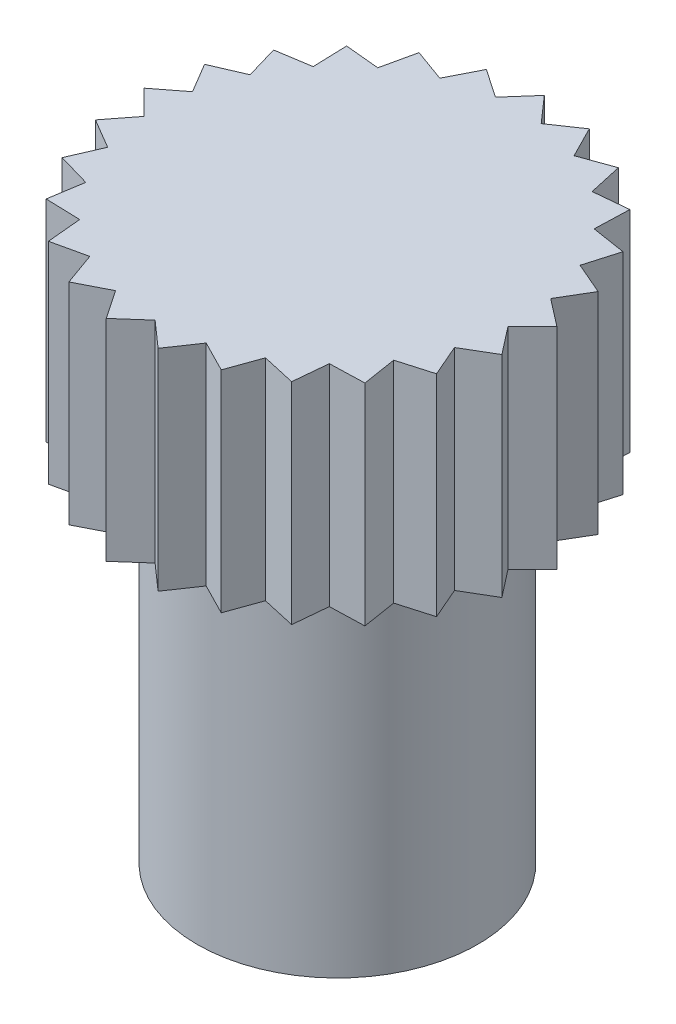
from build123d import *

# Parameters (mm, degrees)
SKETCH1_R           = 2
BOSS_EXTRUDE1_DEPTH = 5.01
BOSS_EXTRUDE2_DEPTH = 3


with BuildPart() as part:
    # Sketch1 → Boss-Extrude1 (new body)
    with BuildSketch(Plane(origin=(0, 0, 0), x_dir=(1, 0, 0), z_dir=(0, 1, 0))):
        with Locations(Location((0, 0, 0), (0, 0, 270))):
            Circle(SKETCH1_R)
    extrude(amount=BOSS_EXTRUDE1_DEPTH)

    # Sketch4 → Boss-Extrude2 (add)
    with BuildSketch(Plane(origin=(0, 5.01, 0), x_dir=(1, 0, 0), z_dir=(0, 1, 0))):
        Polygon((-0.325866407, 2.579498223), (0, 2.95), (0.325866407, 2.579498223), (0.733635167, 2.857320325), (0.957123837, 2.417418863), (1.421173339, 2.585104706), (1.528241656, 2.103444185), (2.019413962, 2.150457451), (2.003334431, 1.657302373), (2.49076738, 1.580689045), (2.352550336, 1.107026158), (2.805616723, 0.911600133), (2.553946852, 0.487191418), (2.944178849, 0.185232033), (2.594869494, -0.163255351), (2.89774739, -0.552774878), (2.472746942, -0.803444185), (2.669239805, -1.25604891), (2.195252606, -1.393149667), (2.273014066, -1.88040077), (1.779822475, -1.895318431), (1.733966494, -2.386600133), (1.252559553, -2.278397368), (1.08596743, -2.742840633), (0.646593707, -2.518316219), (0.369733039, -2.926738369), (0, -2.6), (-0.369733039, -2.926738369), (-0.646593707, -2.518316219), (-1.08596743, -2.742840633), (-1.252559553, -2.278397368), (-1.733966494, -2.386600133), (-1.779822475, -1.895318431), (-2.273014066, -1.88040077), (-2.195252606, -1.393149667), (-2.669239805, -1.25604891), (-2.472746942, -0.803444185), (-2.89774739, -0.552774878), (-2.594869494, -0.163255351), (-2.944178849, 0.185232033), (-2.553946852, 0.487191418), (-2.805616723, 0.911600133), (-2.352550336, 1.107026158), (-2.49076738, 1.580689045), (-2.003334431, 1.657302373), (-2.019413962, 2.150457451), (-1.528241656, 2.103444185), (-1.421173339, 2.585104706), (-0.957123837, 2.417418863), (-0.733635167, 2.857320325), align=None)
    extrude(amount=BOSS_EXTRUDE2_DEPTH)


solid = part.part
